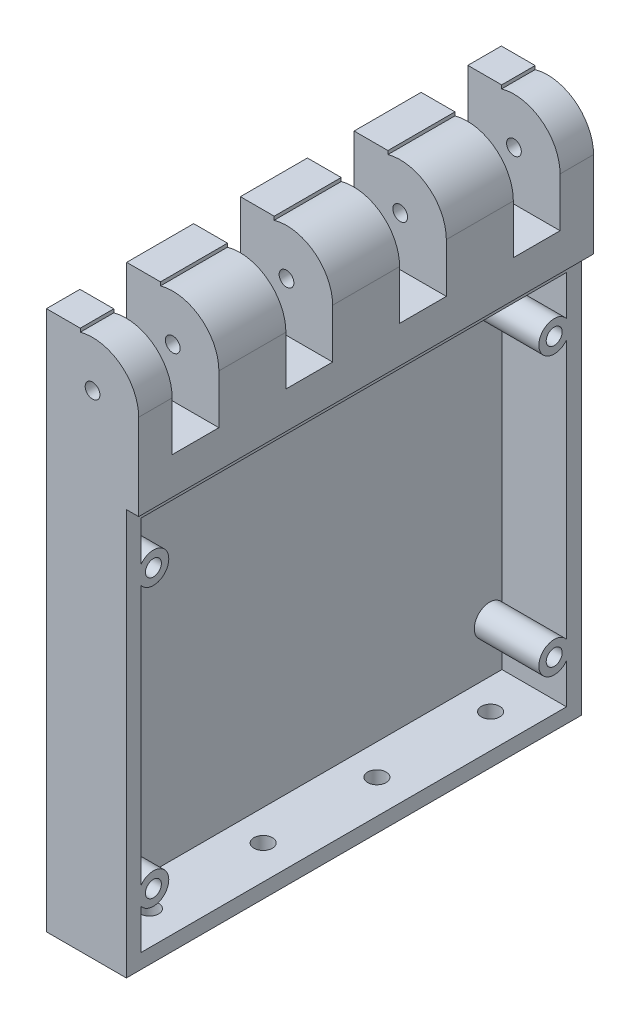
from build123d import *

# Parameters (mm, degrees)
BOSS_EXTRUDE1_DEPTH     = 37
SKETCH2_W               = 5.5
SKETCH2_H               = 7.8
BOSS_EXTRUDE2_DEPTH     = 37
CUT_EXTRUDE1_DEPTH      = 89.460443137
CUT_EXTRUDE1_DEPTH_BACK = 89.460443137
SKETCH3_W               = 7.6
SKETCH3_H               = 17
CUT_EXTRUDE2_DEPTH      = 89.460443137
CUT_EXTRUDE2_DEPTH_BACK = 89.460443137
SKETCH4_R               = 1.2
CUT_EXTRUDE3_DEPTH      = 89.460443137
CUT_EXTRUDE3_DEPTH_BACK = 89.460443137
SKETCH5_W               = 2.5
SKETCH5_H               = 67
CUT_EXTRUDE4_DEPTH      = 90.09545443
CUT_EXTRUDE4_DEPTH_BACK = 10.5
SKETCH6_W               = 69.2
SKETCH6_H               = 61.2
SKETCH7_R               = 2.5
BOSS_EXTRUDE8_DEPTH     = 10.5
SKETCH8_R               = 1.3
CUT_EXTRUDE5_DEPTH      = 8
SKETCH9_R               = 1.5
CUT_EXTRUDE6_DEPTH      = 3


with BuildPart() as part:
    # Sketch1 → Boss-Extrude1 (new, symmetric)
    with BuildSketch(Plane.XY):
        with BuildLine():
            Line((7.5, 0), (7.5, -80))
            Line((7.5, -80), (-7.5, -80))
            Line((-7.5, -80), (-7.5, 0))
            ThreePointArc((-7.5, 0), (0, 7.5), (7.5, 0))
        make_face()
    extrude(amount=BOSS_EXTRUDE1_DEPTH, both=True)

    # Sketch2 → Boss-Extrude2 (add, symmetric)
    with BuildSketch(Plane.XY):
        with Locations((-4.75, 3.9)):
            Rectangle(SKETCH2_W, SKETCH2_H)
    extrude(amount=BOSS_EXTRUDE2_DEPTH, both=True)

    # Sketch3 → Cut-Extrude1 (cut, two sides: drawn at the far end of the back side and taken through both)
    with BuildSketch(Plane(origin=(0, 0, 0), x_dir=(0, 0, -1), z_dir=(1, 0, 0)).offset(-CUT_EXTRUDE1_DEPTH_BACK)):
        with Locations((-9.25, 0.5)):
            Rectangle(SKETCH3_W, SKETCH3_H)
        with Locations((-27.75, 0.5)):
            Rectangle(SKETCH3_W, SKETCH3_H)
        with Locations((27.75, 0.5)):
            Rectangle(SKETCH3_W, SKETCH3_H)
        with Locations((9.25, 0.5)):
            Rectangle(SKETCH3_W, SKETCH3_H)
    extrude(amount=CUT_EXTRUDE1_DEPTH + CUT_EXTRUDE1_DEPTH_BACK, mode=Mode.SUBTRACT)

    # Sketch4 → Cut-Extrude2 (cut, two sides: drawn at the far end of the back side and taken through both)
    with BuildSketch(Plane.XY.offset(-CUT_EXTRUDE2_DEPTH_BACK)):
        Circle(SKETCH4_R)
    extrude(amount=CUT_EXTRUDE2_DEPTH + CUT_EXTRUDE2_DEPTH_BACK, mode=Mode.SUBTRACT)

    # Sketch5 → Cut-Extrude3 (cut, two sides: drawn at the far end of the back side and taken through both)
    with BuildSketch(Plane.XY.offset(-CUT_EXTRUDE3_DEPTH_BACK)):
        with Locations((6.75, -47.5)):
            Rectangle(SKETCH5_W, SKETCH5_H)
    extrude(amount=CUT_EXTRUDE3_DEPTH + CUT_EXTRUDE3_DEPTH_BACK, mode=Mode.SUBTRACT)

    # Sketch6 → Cut-Extrude4 (cut, two sides: drawn at the far end of the back side and taken through both)
    with BuildSketch(Plane(origin=(5.5, 0, 0), x_dir=(0, 0, -1), z_dir=(1, 0, 0)).offset(-CUT_EXTRUDE4_DEPTH_BACK)):
        with Locations((0, -47)):
            Rectangle(SKETCH6_W, SKETCH6_H)
    extrude(amount=CUT_EXTRUDE4_DEPTH + CUT_EXTRUDE4_DEPTH_BACK, mode=Mode.SUBTRACT)

    # Sketch7 → Boss-Extrude8 (add)
    with BuildSketch(Plane(origin=(-5, 0, 0), x_dir=(0, 0, -1), z_dir=(1, 0, 0))):
        with Locations((-32.6, -69.6)):
            Circle(SKETCH7_R)
        with Locations((-32.6, -24.4)):
            Circle(SKETCH7_R)
        with Locations((32.6, -24.4)):
            Circle(SKETCH7_R)
        with Locations((32.6, -69.6)):
            Circle(SKETCH7_R)
    extrude(amount=BOSS_EXTRUDE8_DEPTH)

    # Sketch8 → Cut-Extrude5 (cut)
    with BuildSketch(Plane(origin=(5.5, 0, 0), x_dir=(0, 0, -1), z_dir=(1, 0, 0))):
        with Locations((-32.6, -24.4)):
            Circle(SKETCH8_R)
        with Locations((32.6, -24.4)):
            Circle(SKETCH8_R)
        with Locations((32.6, -69.6)):
            Circle(SKETCH8_R)
        with Locations((-32.6, -69.6)):
            Circle(SKETCH8_R)
    extrude(amount=-CUT_EXTRUDE5_DEPTH, mode=Mode.SUBTRACT)

    # Sketch9 → Cut-Extrude6 (cut)
    with BuildSketch(Plane.XZ.offset(80)):
        with Locations(Location((0, -9.25, 0), (0, 0, 270))):
            Circle(SKETCH9_R)
        with Locations(Location((0, -27.75, 0), (0, 0, 270))):
            Circle(SKETCH9_R)
        with Locations(Location((0, 9.25, 0), (0, 0, 270))):
            Circle(SKETCH9_R)
        with Locations(Location((0, 27.75, 0), (0, 0, 270))):
            Circle(SKETCH9_R)
    extrude(amount=-CUT_EXTRUDE6_DEPTH, mode=Mode.SUBTRACT)


solid = part.part
